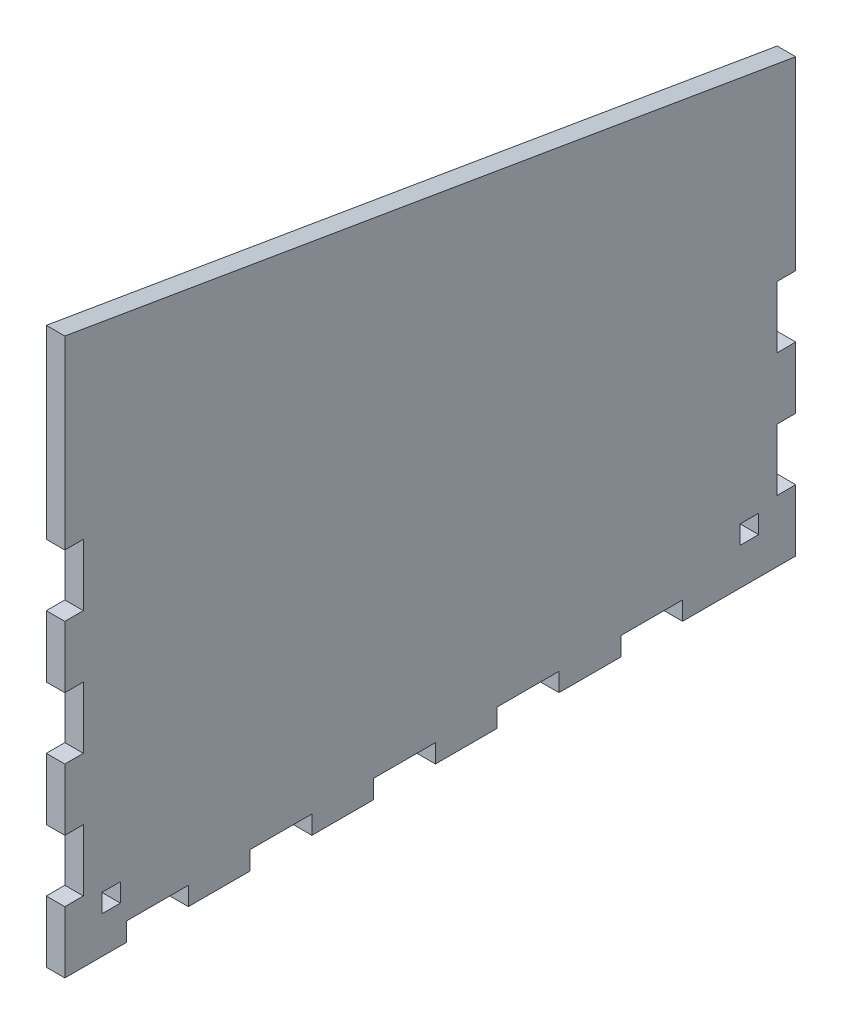
from build123d import *

# Parameters (mm, degrees)
SKETCH1_W           = 3
SKETCH1_H           = 3
BOSS_EXTRUDE1_DEPTH = 3


with BuildPart() as part:
    # Sketch1 → Boss-Extrude1 (new body)
    with BuildSketch(Plane(origin=(0, 0, 0), x_dir=(0, 0, -1), z_dir=(1, 0, 0))):
        Polygon((0, 0), (10, 0), (10, 3), (20, 3), (20, 0), (30, 0), (30, 3), (40, 3), (40, 0), (50, 0), (50, 3), (60, 3), (60, 0), (70, 0), (70, 3), (80, 3), (80, 0), (90, 0), (90, 3), (100, 3), (100, 0), (118.321595662, 0), (118.321595662, 10), (115.321595662, 10), (115.321595662, 20), (118.321595662, 20), (118.321595662, 30), (115.321595662, 30), (115.321595662, 40), (118.321595662, 40), (118.321595662, 70), (0, 90), (0, 60), (3.003699444, 60), (3.003699444, 50), (0, 50), (0, 40), (3.003699444, 40), (3.003699444, 30), (0, 30), (0, 20), (3.003699444, 20), (3.003699444, 10), (0, 10), align=None)
        with Locations((110.82, 7.5)):
            Rectangle(SKETCH1_W, SKETCH1_H, mode=Mode.SUBTRACT)
        with Locations((7.5, 7.5)):
            Rectangle(SKETCH1_W, SKETCH1_H, mode=Mode.SUBTRACT)
    extrude(amount=BOSS_EXTRUDE1_DEPTH)


solid = part.part
